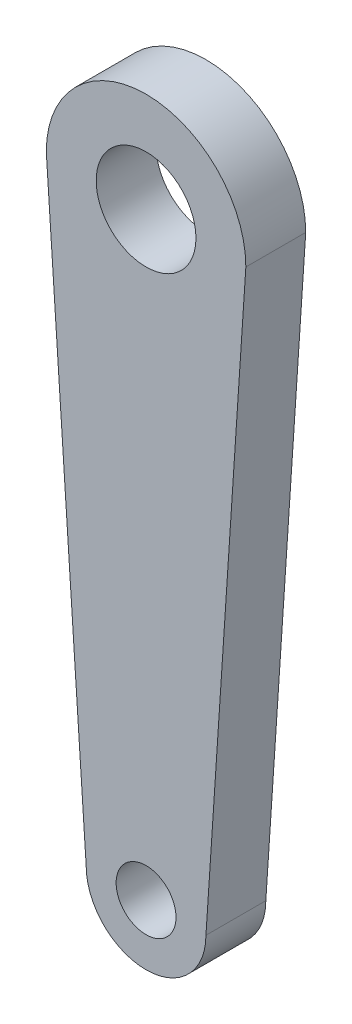
from build123d import *

# Parameters (mm, degrees)
BOSS_EXTRUDE1_DEPTH = 3
SKETCH2_R           = 2.5
CUT_EXTRUDE1_DEPTH  = 34.51119216
SKETCH3_R           = 1.5
CUT_EXTRUDE2_DEPTH  = 34.51119216


with BuildPart() as part:
    # Sketch1 → Boss-Extrude1 (new body)
    with BuildSketch(Plane.XY):
        with BuildLine():
            Line((-5, 0), (-3, -30))
            ThreePointArc((-3, -30), (0, -33), (3, -30))
            Line((3, -30), (5, 0))
            ThreePointArc((5, 0), (0, 5), (-5, 0))
        make_face()
    extrude(amount=BOSS_EXTRUDE1_DEPTH)

    # Sketch2 → Cut-Extrude1 (cut, through all)
    with BuildSketch(Plane.XY.offset(3)):
        Circle(SKETCH2_R)
    extrude(amount=-CUT_EXTRUDE1_DEPTH, mode=Mode.SUBTRACT)

    # Sketch3 → Cut-Extrude2 (cut, through all)
    with BuildSketch(Plane.XY.offset(3)):
        with Locations((0, -29.973330892)):
            Circle(SKETCH3_R)
    extrude(amount=-CUT_EXTRUDE2_DEPTH, mode=Mode.SUBTRACT)


solid = part.part
